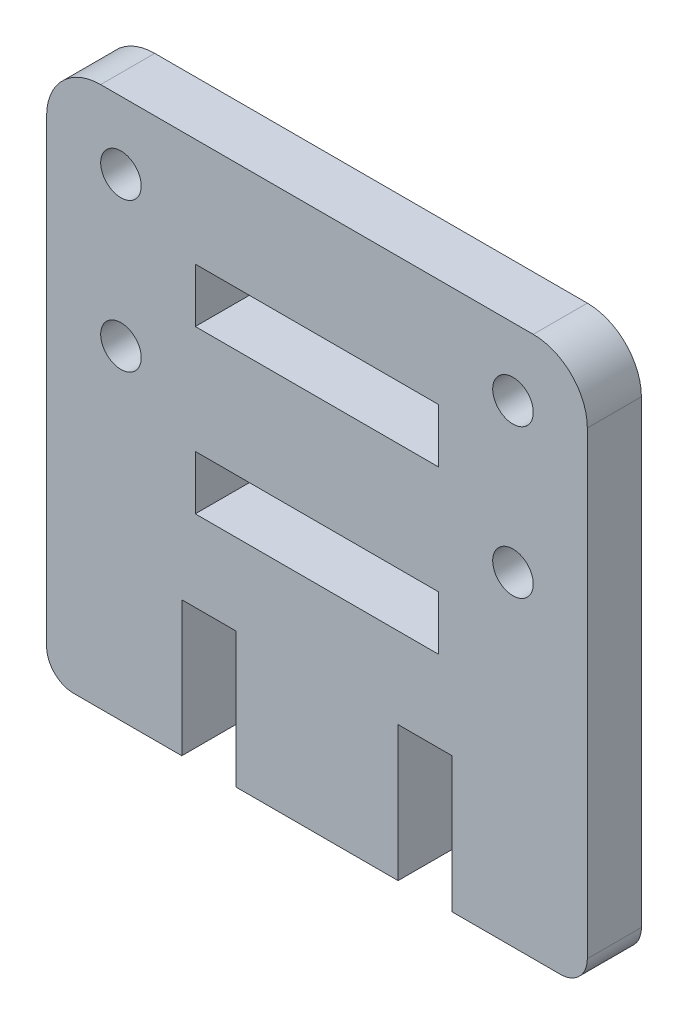
from build123d import *

# Parameters (mm, degrees)
MODEL_R             = 0.75
MODEL_W             = 9
MODEL_H             = 2
BOSS_EXTRUDE1_DEPTH = 2


with BuildPart() as part:
    # Model → Boss-Extrude1 (new body)
    with BuildSketch(Plane.XY):
        with BuildLine():
            Line((1972.109841287, 1171.284705077), (1972.109841287, 1166.284705077))
            Line((1972.109841287, 1166.284705077), (1978.109841287, 1166.284705077))
            Line((1978.109841287, 1166.284705077), (1978.109841287, 1171.284705077))
            Line((1978.109841287, 1171.284705077), (1980.109841287, 1171.284705077))
            Line((1980.109841287, 1171.284705077), (1980.109841287, 1166.284705077))
            Line((1980.109841287, 1166.284705077), (1984.109841287, 1166.284705077))
            ThreePointArc((1984.109841287, 1166.284705077), (1984.816948068, 1166.577598295), (1985.109841287, 1167.284705077))
            Line((1985.109841287, 1167.284705077), (1985.109841287, 1184.284705077))
            ThreePointArc((1985.109841287, 1184.284705077), (1984.524054849, 1185.698918639), (1983.109841287, 1186.284705077))
            Line((1983.109841287, 1186.284705077), (1967.109841287, 1186.284705077))
            ThreePointArc((1967.109841287, 1186.284705077), (1965.695627724, 1185.698918639), (1965.109841287, 1184.284705077))
            Line((1965.109841287, 1184.284705077), (1965.109841287, 1167.284705077))
            ThreePointArc((1965.109841287, 1167.284705077), (1965.402734505, 1166.577598295), (1966.109841287, 1166.284705077))
            Line((1966.109841287, 1166.284705077), (1970.109841287, 1166.284705077))
            Line((1970.109841287, 1166.284705077), (1970.109841287, 1171.284705077))
            Line((1970.109841287, 1171.284705077), (1972.109841287, 1171.284705077))
        make_face()
        with Locations((1982.359841287, 1183.784705077)):
            Circle(MODEL_R, mode=Mode.SUBTRACT)
        with Locations((1967.859841287, 1183.784705077)):
            Circle(MODEL_R, mode=Mode.SUBTRACT)
        with Locations((1982.359841287, 1178.284705077)):
            Circle(MODEL_R, mode=Mode.SUBTRACT)
        with Locations((1967.859841287, 1178.284705077)):
            Circle(MODEL_R, mode=Mode.SUBTRACT)
        with Locations((1975.109841287, 1181.284705077)):
            Rectangle(MODEL_W, MODEL_H, mode=Mode.SUBTRACT)
        with Locations((1975.109841287, 1175.284705077)):
            Rectangle(MODEL_W, MODEL_H, mode=Mode.SUBTRACT)
    extrude(amount=BOSS_EXTRUDE1_DEPTH)


solid = part.part
